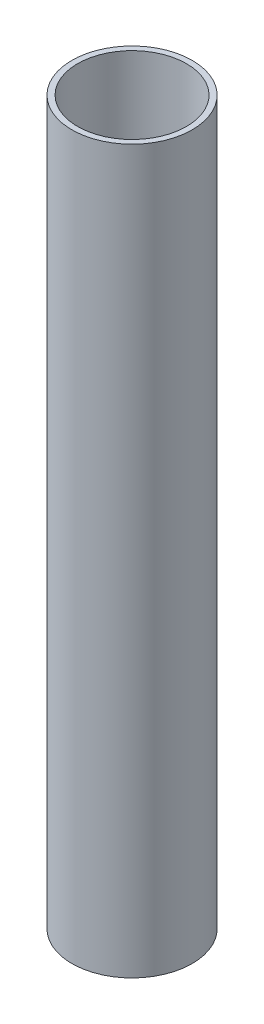
from build123d import *

# Parameters (mm, degrees)
SKETCH1_R           = 25.4
SKETCH1_R_2         = 22.987
BOSS_EXTRUDE1_DEPTH = 304.8


with BuildPart() as part:
    # Sketch1 → Boss-Extrude1 (new body)
    with BuildSketch(Plane(origin=(0, 0, 0), x_dir=(1, 0, 0), z_dir=(0, 1, 0))):
        with Locations(Location((0, 0, 0), (0, 0, 90))):
            Circle(SKETCH1_R)
        with Locations(Location((0, 0, 0), (0, 0, 90))):
            Circle(SKETCH1_R_2, mode=Mode.SUBTRACT)
    extrude(amount=BOSS_EXTRUDE1_DEPTH)


solid = part.part
